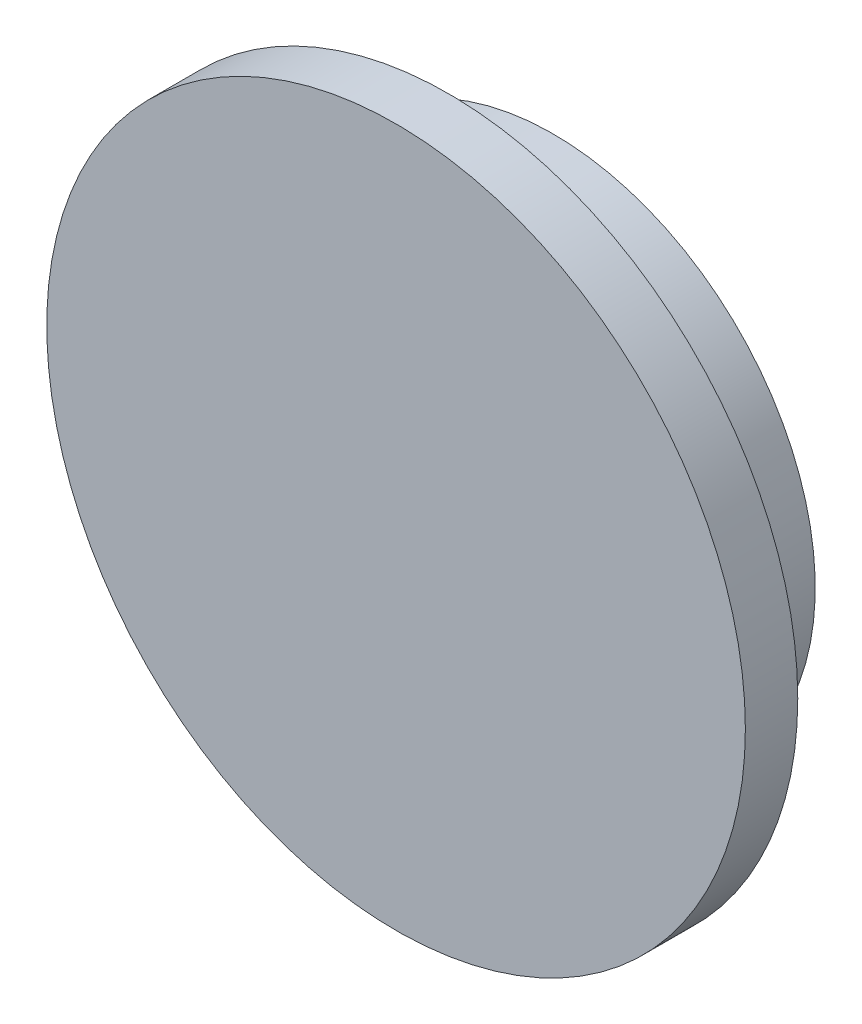
from build123d import *

# Parameters (mm, degrees)
SKETCH_1_R          = 200
EXTRUDE_3_DEPTH     = 30
SKETCH_3_R          = 150
EXTRUDE_4_DEPTH     = 60
SKETCH_4_R          = 48
CUT_EXTRUDE_1_DEPTH = 45


with BuildPart() as part:
    # 草图1 → 凸台-拉伸3 (new body)
    with BuildSketch(Plane.XY):
        Circle(SKETCH_1_R)
    extrude(amount=EXTRUDE_3_DEPTH)

    # 草图3 → 凸台-拉伸4 (add)
    with BuildSketch(Plane(origin=(0, 0, 0), x_dir=(-1, 0, 0), z_dir=(0, 0, -1))):
        Circle(SKETCH_3_R)
    extrude(amount=EXTRUDE_4_DEPTH)

    # 草图4 → 切除-拉伸1 (cut)
    with BuildSketch(Plane(origin=(0, 0, -60), x_dir=(-1, 0, 0), z_dir=(0, 0, -1))):
        Circle(SKETCH_4_R)
    extrude(amount=-CUT_EXTRUDE_1_DEPTH, mode=Mode.SUBTRACT)


solid = part.part
